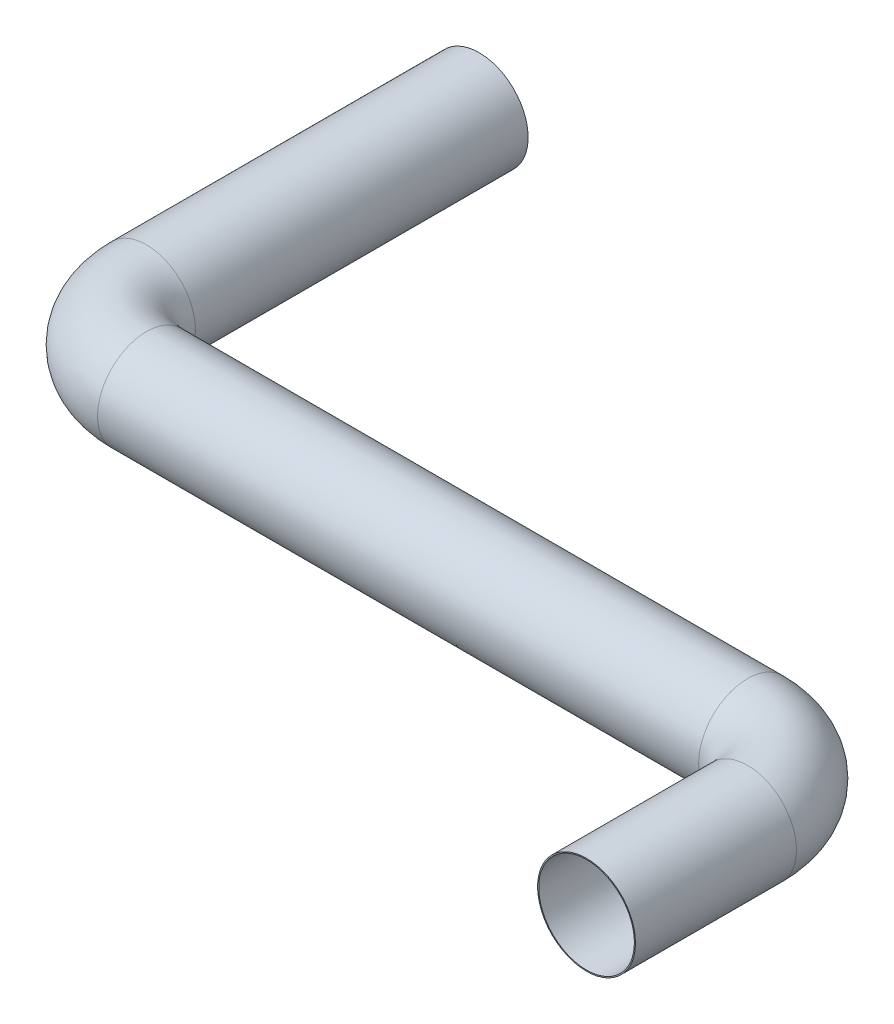
from build123d import *

# Parameters (mm, degrees)
SKETCH2_R           = 45.59
SKETCH2_R_2         = 44.59
BOSS_EXTRUDE3_START = 130
SKETCH4_R           = 45.59
SKETCH4_R_2         = 44.59
BOSS_EXTRUDE3_DEPTH = 130


with BuildPart() as part:
    # Sweep1: sweep along a path in Sketch1
    with BuildLine(Plane(origin=(0, 0, 0), x_dir=(1, 0, 0), z_dir=(0, 1, 0))) as sweep1_path:
        Line((0, 0), (0, 150))
        ThreePointArc((0, 150), (-20.502525317, 199.497474683), (-70, 220))
        Line((-70, 220), (-630, 220))
        ThreePointArc((-630, 220), (-679.497474683, 240.502525317), (-700, 290))
        Line((-700, 290), (-700, 470))
    # Sketch2 → Sweep1 (sweep)
    with BuildSketch(Plane.XY):
        Circle(SKETCH2_R)
        Circle(SKETCH2_R_2, mode=Mode.SUBTRACT)
    sweep(path=sweep1_path.line)

    # Sketch4 → Boss-Extrude3 (add)
    with BuildSketch(Plane(origin=(0, 0, -470), x_dir=(-1, 0, 0), z_dir=(0, 0, -1)).offset(BOSS_EXTRUDE3_START)):
        with Locations((700, 0)):
            Circle(SKETCH4_R)
        with Locations((700, 0)):
            Circle(SKETCH4_R_2, mode=Mode.SUBTRACT)
    extrude(amount=-BOSS_EXTRUDE3_DEPTH)


solid = part.part
